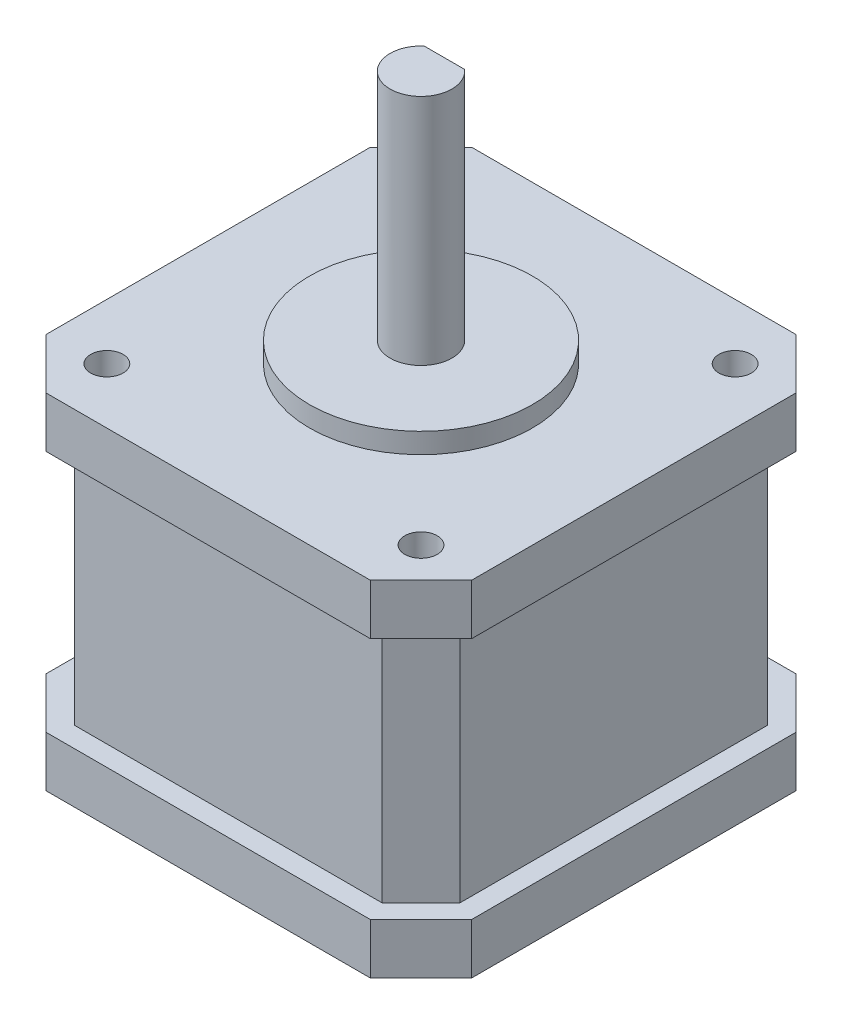
from build123d import *

# Parameters (mm, degrees)
SKETCH_1_W          = 42
SKETCH_1_H          = 42
EXTRUDE_1_DEPTH     = 34
SKETCH_2_R          = 11
EXTRUDE_2_DEPTH     = 2
SKETCH_3_R          = 3.05
EXTRUDE_3_DEPTH     = 23
SKETCH_4_W          = 6.575865178
SKETCH_4_H          = 2.726578245
CUT_EXTRUDE_1_DEPTH = 18
CUT_EXTRUDE_2_DEPTH = 46.144213361
CHAMFER_1_SIZE      = 5
CUT_EXTRUDE_3_DEPTH = 24
SKETCH_7_W          = 12
SKETCH_7_H          = 5
EXTRUDE_4_DEPTH     = 5
SKETCH_8_W          = 9.77285119
SKETCH_8_H          = 3.692990437
CUT_EXTRUDE_4_DEPTH = 4


with BuildPart() as part:
    # 草图1 → 凸台-拉伸1 (new body)
    with BuildSketch(Plane(origin=(0, 0, 0), x_dir=(1, 0, 0), z_dir=(0, 1, 0))):
        Rectangle(SKETCH_1_W, SKETCH_1_H)
    extrude(amount=EXTRUDE_1_DEPTH)

    # 草图2 → 凸台-拉伸2 (add)
    with BuildSketch(Plane(origin=(0, 34, 0), x_dir=(1, 0, 0), z_dir=(0, 1, 0))):
        with Locations(Location((0, 0, 0), (0, 0, 270))):
            Circle(SKETCH_2_R)
    extrude(amount=EXTRUDE_2_DEPTH)

    # 草图3 → 凸台-拉伸3 (add)
    with BuildSketch(Plane(origin=(0, 36, 0), x_dir=(1, 0, 0), z_dir=(0, 1, 0))):
        with Locations(Location((0, 0, 0), (0, 0, 270))):
            Circle(SKETCH_3_R)
    extrude(amount=EXTRUDE_3_DEPTH)

    # 草图4 → 切除-拉伸1 (cut)
    with BuildSketch(Plane(origin=(0, 59, 0), x_dir=(1, 0, 0), z_dir=(0, 1, 0))):
        with Locations((-0.016038696, 3.672861282)):
            Rectangle(SKETCH_4_W, SKETCH_4_H)
    extrude(amount=-CUT_EXTRUDE_1_DEPTH, mode=Mode.SUBTRACT)

    # 草图5 → 切除-拉伸2 (cut, through all)
    with BuildSketch(Plane(origin=(0, 34, 0), x_dir=(1, 0, 0), z_dir=(0, 1, 0))):
        with BuildLine():
            ThreePointArc((17.1, -15.5), (16.63137085, -14.36862915), (15.5, -13.9))
            Line((15.5, -13.9), (15.5, -15.5))
            Line((15.5, -15.5), (13.9, -15.5))
            ThreePointArc((13.9, -15.5), (15.5, -17.1), (17.1, -15.5))
        make_face()
        with BuildLine():
            Line((15.5, -15.5), (15.5, -13.9))
            ThreePointArc((15.5, -13.9), (14.36862915, -14.36862915), (13.9, -15.5))
            Line((13.9, -15.5), (15.5, -15.5))
        make_face()
        with BuildLine():
            ThreePointArc((-13.9, -15.5), (-14.36862915, -14.36862915), (-15.5, -13.9))
            Line((-15.5, -13.9), (-15.5, -15.5))
            Line((-15.5, -15.5), (-13.9, -15.5))
        make_face()
        with BuildLine():
            Line((-15.5, -15.5), (-15.5, -13.9))
            ThreePointArc((-15.5, -13.9), (-16.63137085, -16.63137085), (-13.9, -15.5))
            Line((-13.9, -15.5), (-15.5, -15.5))
        make_face()
        with BuildLine():
            ThreePointArc((-15.5, 13.9), (-14.36862915, 14.36862915), (-13.9, 15.5))
            Line((-13.9, 15.5), (-15.5, 15.5))
            Line((-15.5, 15.5), (-15.5, 13.9))
        make_face()
        with BuildLine():
            Line((-15.5, 15.5), (-13.9, 15.5))
            ThreePointArc((-13.9, 15.5), (-16.63137085, 16.63137085), (-15.5, 13.9))
            Line((-15.5, 13.9), (-15.5, 15.5))
        make_face()
        with BuildLine():
            ThreePointArc((17.1, 15.5), (15.5, 17.1), (13.9, 15.5))
            Line((13.9, 15.5), (15.5, 15.5))
            Line((15.5, 15.5), (15.5, 13.9))
            ThreePointArc((15.5, 13.9), (16.63137085, 14.36862915), (17.1, 15.5))
        make_face()
        with BuildLine():
            Line((15.5, 15.5), (13.9, 15.5))
            ThreePointArc((13.9, 15.5), (14.36862915, 14.36862915), (15.5, 13.9))
            Line((15.5, 13.9), (15.5, 15.5))
        make_face()
    extrude(amount=-CUT_EXTRUDE_2_DEPTH, mode=Mode.SUBTRACT)

    # 倒角1
    chamfer_1_edges = [part.edges().sort_by_distance(p)[0] for p in [
        (-21, 17, -21),
        (21, 17, -21),
        (21, 17, 21),
        (-21, 17, 21),
    ]]
    chamfer(chamfer_1_edges, length=CHAMFER_1_SIZE)

    # 草图6 → 切除-拉伸3 (cut)
    with BuildSketch(Plane(origin=(0, 5, 0), x_dir=(-1, 0, 0), z_dir=(0, -1, 0))):
        Polygon((-21, 16), (-21, -16), (-16, -21), (16, -21), (21, -16), (21, 16), (16, 21), (-16, 21), align=None)
        Polygon((-19, 15.171572875), (-19, -15.171572875), (-15.171572875, -19), (15.171572875, -19), (19, -15.171572875), (19, 15.171572875), (15.171572875, 19), (-15.171572875, 19), align=None, mode=Mode.SUBTRACT)
    extrude(amount=-CUT_EXTRUDE_3_DEPTH, mode=Mode.SUBTRACT)

    # 草图7 → 凸台-拉伸4 (add)
    with BuildSketch(Plane(origin=(0, 0, -21), x_dir=(-1, 0, 0), z_dir=(0, 0, -1))):
        with Locations((0, 2.5)):
            Rectangle(SKETCH_7_W, SKETCH_7_H)
    extrude(amount=EXTRUDE_4_DEPTH)

    # 草图8 → 切除-拉伸4 (cut)
    with BuildSketch(Plane(origin=(0, 0, -26), x_dir=(-1, 0, 0), z_dir=(0, 0, -1))):
        with Locations((0.097667739, 3.153504782)):
            Rectangle(SKETCH_8_W, SKETCH_8_H)
    extrude(amount=-CUT_EXTRUDE_4_DEPTH, mode=Mode.SUBTRACT)


solid = part.part
